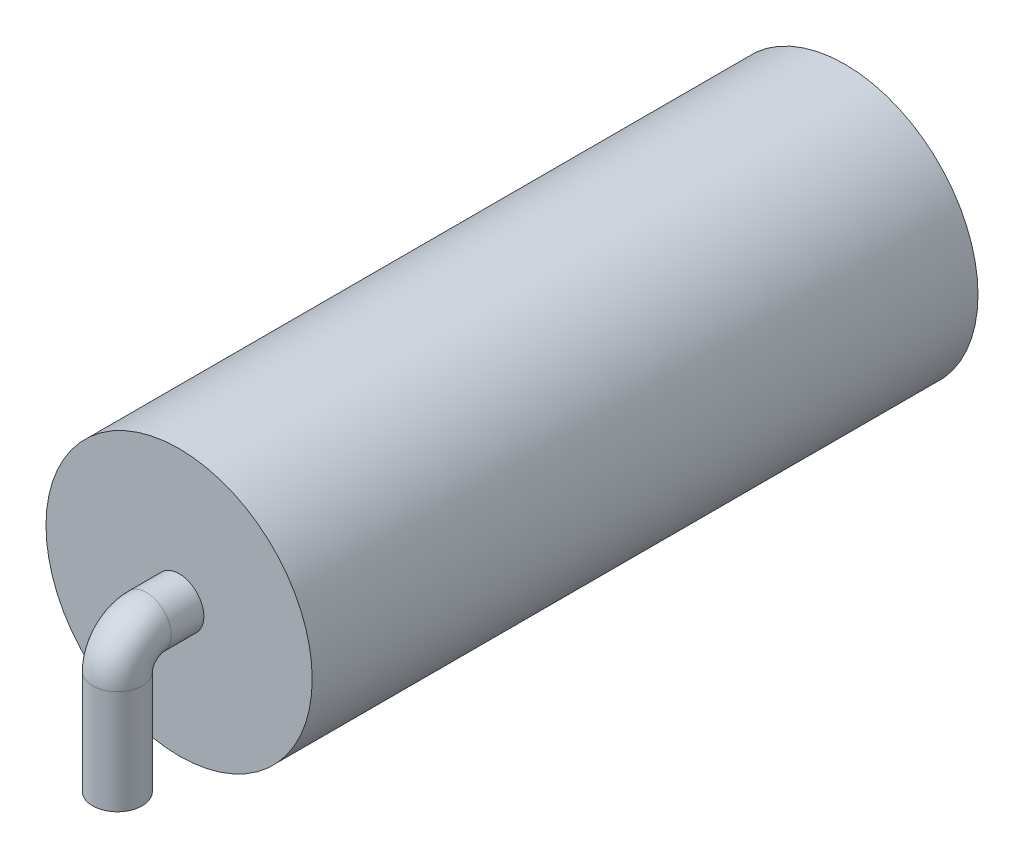
from build123d import *

# Parameters (mm, degrees)
SKETCH1_R           = 2.285
BOSS_EXTRUDE1_DEPTH = 5.715
SWEEP1_PROFILE_R    = 0.425


with BuildPart() as part:
    # Sketch1 → Boss-Extrude1 (new, symmetric)
    with BuildSketch(Plane.XY):
        Circle(SKETCH1_R)
    extrude(amount=BOSS_EXTRUDE1_DEPTH, both=True)

    # Sweep1: sweep along a path in Sketch2
    with BuildLine(Plane(origin=(0, 0, 0), x_dir=(0, 0, -1), z_dir=(1, 0, 0))) as sweep1_path:
        Line((-6.775, -2.285), (-6.775, -0.5))
        ThreePointArc((-6.775, -0.5), (-6.628553391, -0.146446609), (-6.275, 0))
        Line((-6.275, 0), (6.275, 0))
        ThreePointArc((6.275, 0), (6.628553391, -0.146446609), (6.775, -0.5))
        Line((6.775, -0.5), (6.775, -2.285))
    # Sweep1 profile (on start of the path) → Sweep1 (sweep)
    with BuildSketch(Plane(origin=(0, -2.285, 6.775), x_dir=(0, 0, 1), z_dir=(0, 1, 0))):
        Circle(SWEEP1_PROFILE_R)
    sweep(path=sweep1_path.line)


solid = part.part
